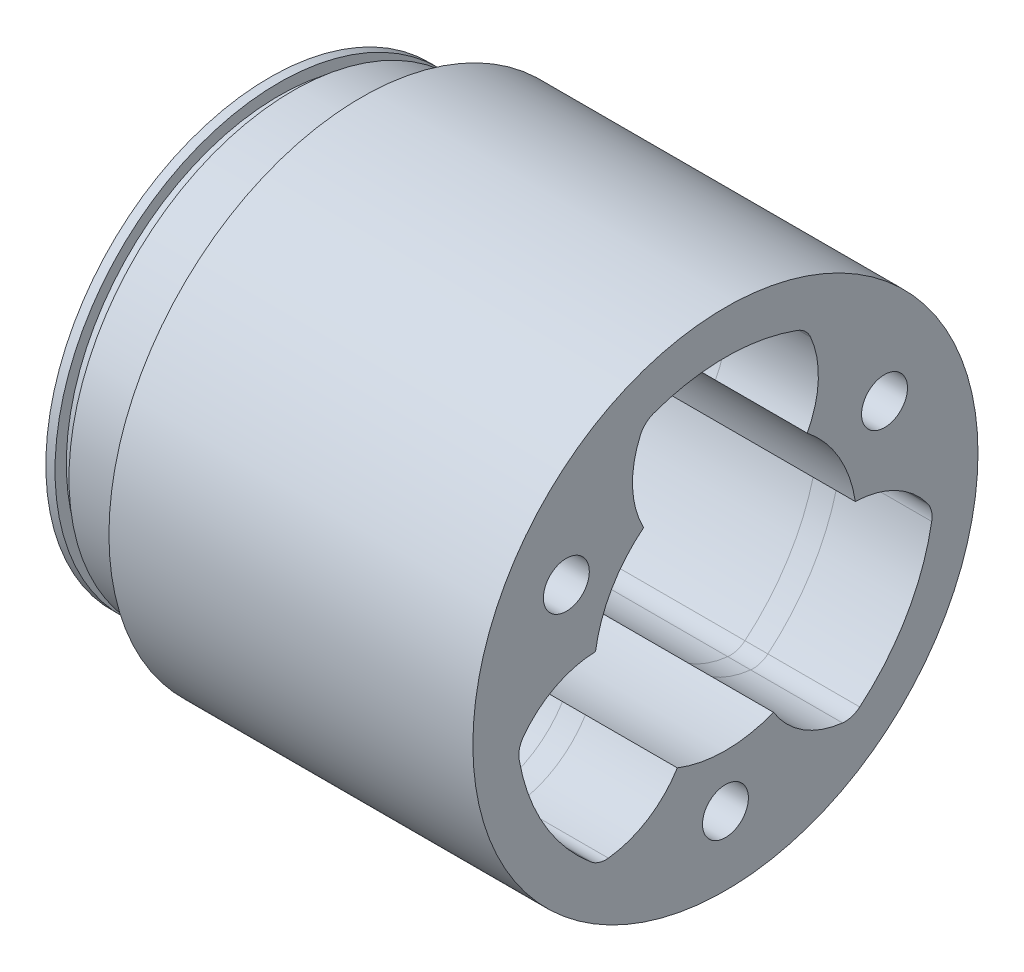
from build123d import *

# Parameters (mm, degrees)
SKETCH4_R                  = 34.925
SKETCH4_R_2                = 18.161
BOSS_EXTRUDE1_DEPTH        = 72.771
CUT_EXTRUDE2_REACH         = 137.172
CUT_EXTRUDE2_START         = 21.75002
TRIPOD_WALLS_R             = 3.175
BOLT_HOLE_FACE_R           = 3.175
SKETCH12_R                 = 3.175
CUT_EXTRUDE3_DEPTH         = 63.5
CUT_EXTRUDE4_START         = -22.44598
SKETCH13_R                 = 34.925
CUT_EXTRUDE4_DEPTH         = 22.44598
SKETCH16_R                 = 22.86
COMPENSATING_SPACING_DEPTH = 1.016
F_1_4_0_2500_DOWEL_HOLE1_D = 6.35
BOLT_CIRCLE_PATTERN_2_R    = 4.1021
F_5_16_CLEARNCE_DEPTH      = 13.716


with BuildPart() as part:
    # Sketch2 → Revolve1 (revolve)
    with BuildSketch(Plane.XY, mode=Mode.PRIVATE) as revolve1_sk:
        Polygon((0, 0), (0, -30.9499), (12.7, -30.9499), (12.7, 0), (3.2004, 0), (3.2004, -1.5621), (1.27, -1.5621), (1.27, 0), align=None)
    revolve(revolve1_sk.sketch.rotate(Axis((11.964521893, -30.9499, 0), (-1, 0, 0)), 90), axis=Axis((11.964521893, -30.9499, 0), (-1, 0, 0)))

    # Sketch4 → Boss-Extrude1 (add)
    with BuildSketch(Plane(origin=(12.7, 0, 0), x_dir=(0, 0, -1), z_dir=(1, 0, 0))):
        with Locations((0, -30.9499)):
            Circle(SKETCH4_R)
        with Locations((0, -30.9499)):
            Circle(SKETCH4_R_2, mode=Mode.SUBTRACT)
    extrude(amount=BOSS_EXTRUDE1_DEPTH)

    # Sketch5 → Cut-Extrude2 (cut, up to next)
    with BuildSketch(Plane(origin=(0, 0, 0), x_dir=(0, 0, -1), z_dir=(1, 0, 0)).offset(CUT_EXTRUDE2_START), mode=Mode.PRIVATE) as cut_extrude2_sk1:
        with BuildLine():
            ThreePointArc((-11.141810341, -4.2233215), (0, -23.4823), (11.141810341, -4.2233215))
            ThreePointArc((11.141810341, -4.2233215), (0, -1.9939), (-11.141810341, -4.2233215))
        make_face()
    cut_extrude2_tool1 = extrude(cut_extrude2_sk1.sketch, amount=CUT_EXTRUDE2_REACH, mode=Mode.PRIVATE) & part.part
    # Sketch5 → Cut-Extrude2 (cut, up to next)
    with BuildSketch(Plane(origin=(0, 0, 0), x_dir=(0, 0, -1), z_dir=(1, 0, 0)).offset(CUT_EXTRUDE2_START), mode=Mode.PRIVATE) as cut_extrude2_sk2:
        with BuildLine():
            ThreePointArc((-28.716801071, -34.664098733), (-25.076631449, -45.427900247), (-17.57499054, -53.962280223))
            ThreePointArc((-17.57499054, -53.962280223), (-6.467131268, -34.683700064), (-28.716801071, -34.664098733))
        make_face()
    cut_extrude2_tool2 = extrude(cut_extrude2_sk2.sketch, amount=CUT_EXTRUDE2_REACH, mode=Mode.PRIVATE) & part.part
    # Sketch5 → Cut-Extrude2 (cut, up to next)
    with BuildSketch(Plane(origin=(0, 0, 0), x_dir=(0, 0, -1), z_dir=(1, 0, 0)).offset(CUT_EXTRUDE2_START), mode=Mode.PRIVATE) as cut_extrude2_sk3:
        with BuildLine():
            ThreePointArc((28.716801071, -34.664098733), (6.467131268, -34.683700064), (17.57499054, -53.962280223))
            ThreePointArc((17.57499054, -53.962280223), (25.076631449, -45.427900247), (28.716801071, -34.664098733))
        make_face()
    cut_extrude2_tool3 = extrude(cut_extrude2_sk3.sketch, amount=CUT_EXTRUDE2_REACH, mode=Mode.PRIVATE) & part.part
    add(cut_extrude2_tool1.solids().sort_by_distance((21.75002, -12.135894, 0))[0], mode=Mode.SUBTRACT)
    add(cut_extrude2_tool2.solids().sort_by_distance((21.75002, -40.356903, 16.293407))[0], mode=Mode.SUBTRACT)
    add(cut_extrude2_tool3.solids().sort_by_distance((21.75002, -40.356903, -16.293407))[0], mode=Mode.SUBTRACT)

    # Tripod walls
    tripod_walls_edges = [part.edges().sort_by_distance(p)[0] for p in [
        (53.61051, -4.2233215, 11.141810341),
        (53.61051, -4.2233215, -11.141810341),
        (53.61051, -53.962280223, 17.57499054),
        (53.61051, -34.664098733, 28.716801071),
        (53.61051, -34.664098733, -28.716801071),
        (53.61051, -53.962280223, -17.57499054),
    ]]
    fillet(tripod_walls_edges, radius=TRIPOD_WALLS_R)

    # Bolt Hole Face
    bolt_hole_face_edges = [part.edges().sort_by_distance(p)[0] for p in [
        (12.7, -30.9499, 18.161),
    ]]
    fillet(bolt_hole_face_edges, radius=BOLT_HOLE_FACE_R)

    # Sketch12 → Cut-Extrude3 (cut)
    with BuildSketch(Plane(origin=(85.471, 0, 0), x_dir=(0, 0, -1), z_dir=(1, 0, 0))):
        with Locations((-21.997045256, -18.2499)):
            Circle(SKETCH12_R)
        with Locations((21.997045256, -18.2499)):
            Circle(SKETCH12_R)
        with Locations((0, -56.3499)):
            Circle(SKETCH12_R)
    extrude(amount=-CUT_EXTRUDE3_DEPTH, mode=Mode.SUBTRACT)

    # Sketch13 → Cut-Extrude4 (cut)
    with BuildSketch(Plane(origin=(85.471, 0, 0), x_dir=(0, 0, -1), z_dir=(1, 0, 0)).offset(CUT_EXTRUDE4_START)):
        with Locations((0, -30.9499)):
            Circle(SKETCH13_R)
    extrude(amount=CUT_EXTRUDE4_DEPTH, mode=Mode.SUBTRACT)

    # Sketch16 → Compensating Spacing (add)
    with BuildSketch(Plane.ZY):
        with Locations(Location((0, -30.9499, 0), (0, 0, 270))):
            Circle(SKETCH16_R)
    extrude(amount=COMPENSATING_SPACING_DEPTH)

    # 1/4 (0.2500) Dowel Hole1 (through all)
    with Locations(Plane(origin=(12.7, 0, 0), x_dir=(0, 0, -1), z_dir=(1, 0, 0))):
        with Locations((0, -21.4249), (9.525, -30.9499), (0, -40.4749), (-9.525, -30.9499)):
            Hole(F_1_4_0_2500_DOWEL_HOLE1_D / 2)

    # Bolt Circle Pattern<2> → 5/16 Clearnce (cut)
    with BuildSketch(Plane(origin=(12.7, 0, 0), x_dir=(0, 0, -1), z_dir=(1, 0, 0))):
        with Locations((0, -30.9499)):
            Circle(BOLT_CIRCLE_PATTERN_2_R)
    extrude(amount=-F_5_16_CLEARNCE_DEPTH, mode=Mode.SUBTRACT)


solid = part.part
